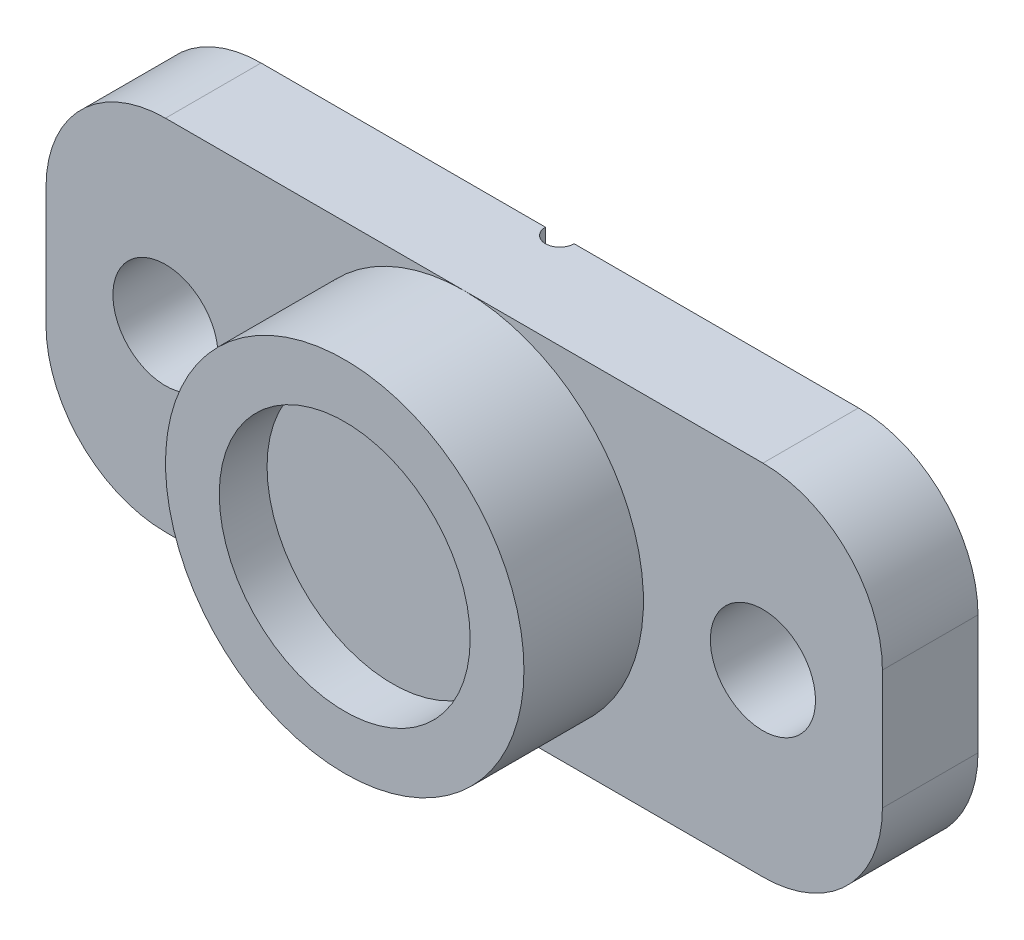
from build123d import *

# Parameters (mm, degrees)
CROQUIS1_W              = 35
CROQUIS1_H              = 15
CROQUIS1_R              = 2.2
SALIENTE_EXTRUIR1_DEPTH = 4
CROQUIS2_R              = 7.5
CROQUIS2_R_2            = 5.25
SALIENTE_EXTRUIR2_DEPTH = 5
REDONDEO1_R             = 5
CROQUIS3_R              = 0.6
CORTAR_EXTRUIR1_DEPTH   = 32
CROQUIS4_R              = 5.25
SALIENTE_EXTRUIR3_DEPTH = 3


with BuildPart() as part:
    # Croquis1 → Saliente-Extruir1 (new body)
    with BuildSketch(Plane.XY):
        with Locations((17.5, 7.5)):
            Rectangle(CROQUIS1_W, CROQUIS1_H)
        with Locations((5, 7.5)):
            Circle(CROQUIS1_R, mode=Mode.SUBTRACT)
        with Locations((30, 7.5)):
            Circle(CROQUIS1_R, mode=Mode.SUBTRACT)
    extrude(amount=SALIENTE_EXTRUIR1_DEPTH)

    # Croquis2 → Saliente-Extruir2 (add)
    with BuildSketch(Plane.XY.offset(4)):
        with Locations(Location((17.5, 7.5, 0), (0, 0, 270))):
            Circle(CROQUIS2_R)
        with Locations((17.5, 7.5)):
            Circle(CROQUIS2_R_2, mode=Mode.SUBTRACT)
    extrude(amount=SALIENTE_EXTRUIR2_DEPTH)

    # Redondeo1
    redondeo1_edges = [part.edges().sort_by_distance(p)[0] for p in [
        (0, 0, 2),
        (0, 15, 2),
        (35, 15, 2),
        (35, 0, 2),
    ]]
    fillet(redondeo1_edges, radius=REDONDEO1_R)

    # Croquis3 → Cortar-Extruir1 (cut)
    with BuildSketch(Plane(origin=(0, 15, 0), x_dir=(1, 0, 0), z_dir=(0, 1, 0))):
        with Locations((17.5, 0)):
            Circle(CROQUIS3_R)
    extrude(amount=-CORTAR_EXTRUIR1_DEPTH, mode=Mode.SUBTRACT)

    # Croquis4 → Saliente-Extruir3 (add)
    with BuildSketch(Plane.XY.offset(4)):
        with Locations((17.5, 7.5)):
            Circle(CROQUIS4_R)
    extrude(amount=SALIENTE_EXTRUIR3_DEPTH)


solid = part.part
